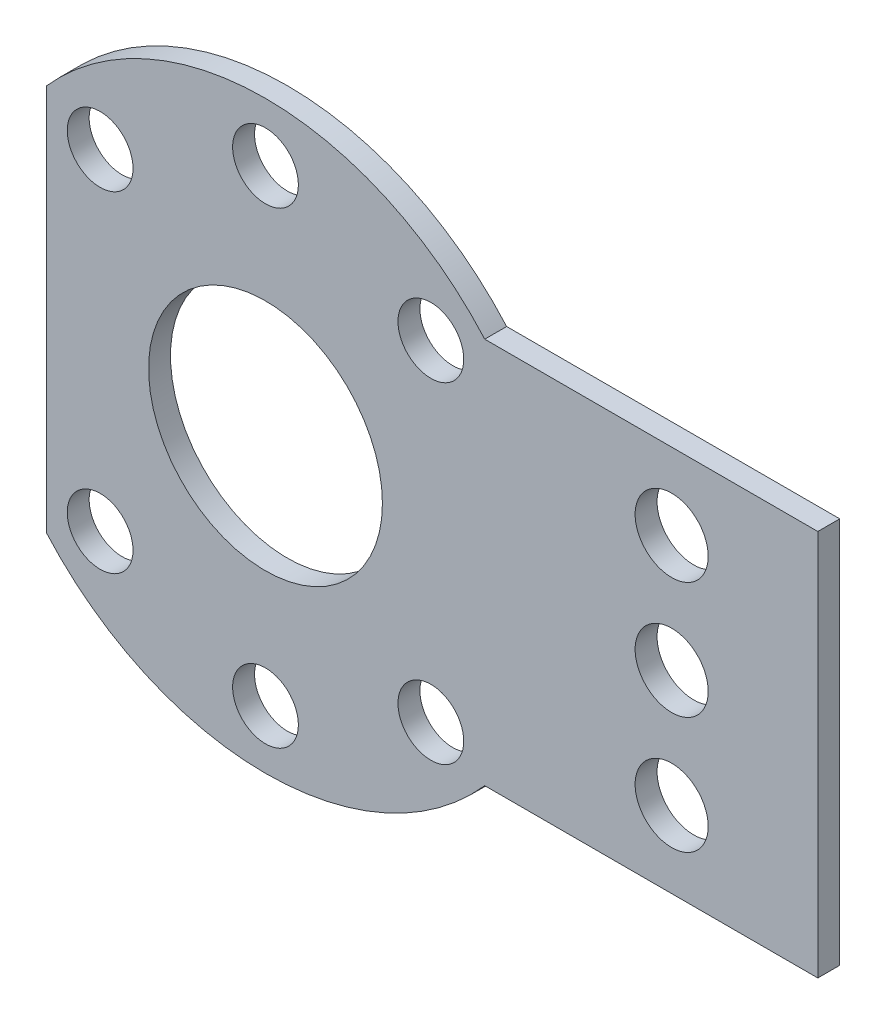
from build123d import *

# Parameters (mm, degrees)
SKETCH1_R           = 2.25
SKETCH1_R_2         = 8
SKETCH1_R_3         = 2.5
BOSS_EXTRUDE1_DEPTH = 1.5


with BuildPart() as part:
    # Sketch1 → Boss-Extrude1 (new body)
    with BuildSketch(Plane.XY):
        with BuildLine():
            Line((15, 13.228756555), (17.79, 13.228756555))
            Line((17.79, 13.228756555), (37.79, 13.228756555))
            Line((37.79, 13.228756555), (37.79, -13.228756555))
            Line((37.79, -13.228756555), (17.79, -13.228756555))
            Line((17.79, -13.228756555), (15, -13.228756555))
            ThreePointArc((15, -13.228756555), (0, -20), (-15, -13.228756555))
            Line((-15, -13.228756555), (-15, 13.228756555))
            ThreePointArc((-15, 13.228756555), (0, 20), (15, 13.228756555))
        make_face()
        with Locations((-11.313708499, 11.313708499)):
            Circle(SKETCH1_R, mode=Mode.SUBTRACT)
        with Locations((0, 16)):
            Circle(SKETCH1_R, mode=Mode.SUBTRACT)
        with Locations((11.313708499, 11.313708499)):
            Circle(SKETCH1_R, mode=Mode.SUBTRACT)
        with Locations((-11.313708499, -11.313708499)):
            Circle(SKETCH1_R, mode=Mode.SUBTRACT)
        with Locations((0, -16)):
            Circle(SKETCH1_R, mode=Mode.SUBTRACT)
        Circle(SKETCH1_R_2, mode=Mode.SUBTRACT)
        with Locations((11.313708499, -11.313708499)):
            Circle(SKETCH1_R, mode=Mode.SUBTRACT)
        with Locations((27.79, 0)):
            Circle(SKETCH1_R_3, mode=Mode.SUBTRACT)
        with Locations((27.79, 8)):
            Circle(SKETCH1_R_3, mode=Mode.SUBTRACT)
        with Locations((27.79, -8)):
            Circle(SKETCH1_R_3, mode=Mode.SUBTRACT)
    extrude(amount=BOSS_EXTRUDE1_DEPTH)


solid = part.part
